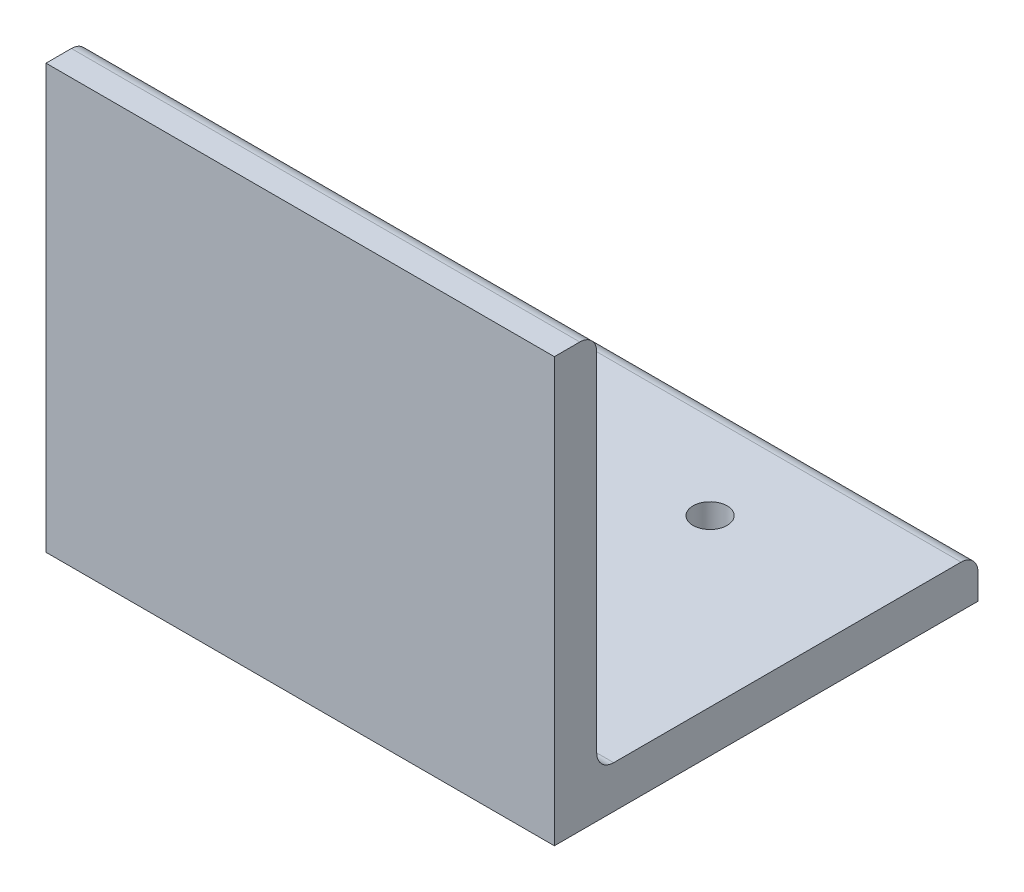
from build123d import *

# Parameters (mm, degrees)
BOSS_EXTRUDE2_DEPTH                                = 76.2
CSK_FOR_10_FLAT_HEAD_MACHINE_SCREW_100_D           = 5.1054
CSK_FOR_10_FLAT_HEAD_MACHINE_SCREW_100_CSINK_D     = 9.779
CSK_FOR_10_FLAT_HEAD_MACHINE_SCREW_100_CSINK_ANGLE = 100


with BuildPart() as part:
    # Sketch1 → Boss-Extrude2 (new body)
    with BuildSketch(Plane(origin=(0, 0, 0), x_dir=(0, 0, -1), z_dir=(1, 0, 0))):
        with BuildLine():
            Line((0, 0), (0, 63.5))
            Line((0, 63.5), (3.81, 63.5))
            ThreePointArc((3.81, 63.5), (5.606051224, 62.756051224), (6.35, 60.96))
            Line((6.35, 60.96), (6.35, 8.89))
            ThreePointArc((6.35, 8.89), (7.093948776, 7.093948776), (8.89, 6.35))
            Line((8.89, 6.35), (60.96, 6.35))
            ThreePointArc((60.96, 6.35), (62.756051224, 5.606051224), (63.5, 3.81))
            Line((63.5, 3.81), (63.5, 0))
            Line((63.5, 0), (0, 0))
        make_face()
    extrude(amount=BOSS_EXTRUDE2_DEPTH)

    # CSK for #10 Flat Head Machine Screw (100)1 (through all)
    with Locations(Plane.XZ):
        with Locations((24.841747853, -48.183252147), (51.358252147, -48.183252147), (51.358252147, -21.666747853), (24.841747853, -21.666747853)):
            CounterSinkHole(CSK_FOR_10_FLAT_HEAD_MACHINE_SCREW_100_D / 2, CSK_FOR_10_FLAT_HEAD_MACHINE_SCREW_100_CSINK_D / 2, counter_sink_angle=CSK_FOR_10_FLAT_HEAD_MACHINE_SCREW_100_CSINK_ANGLE)


solid = part.part
